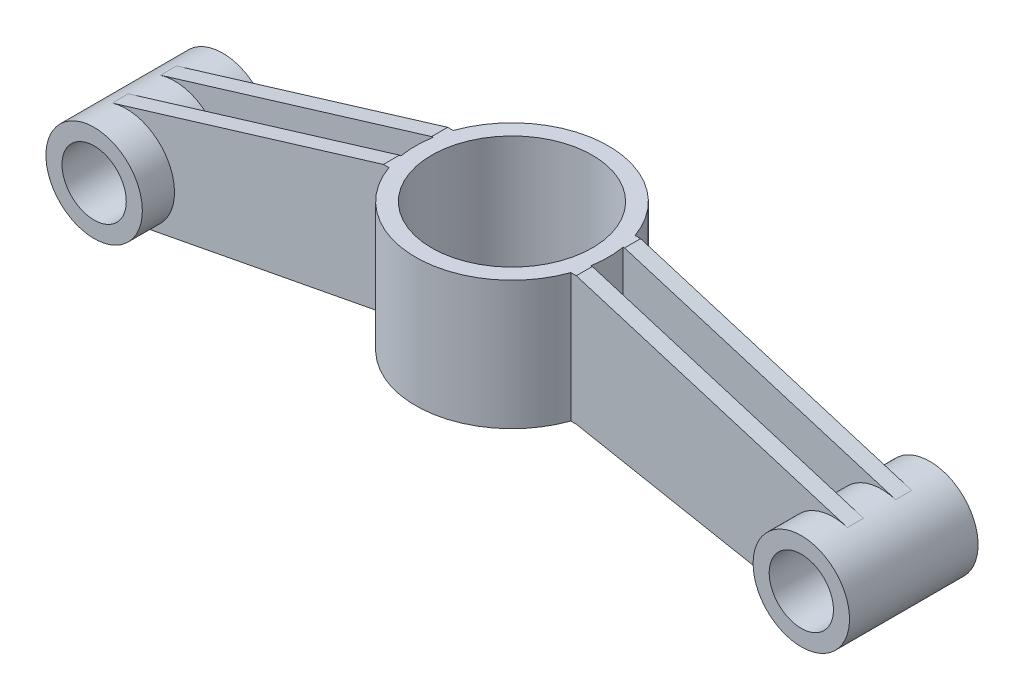
from build123d import *

# Parameters (mm, degrees)
SKETCH1_R             = 30
SKETCH1_R_2           = 25
BOSS_EXTRUDE1_DEPTH   = 40
SKETCH4_R             = 15
SKETCH4_R_2           = 10
BOSS_EXTRUDE2_DEPTH   = 20
BOSS_EXTRUDE2_2_DEPTH = 20
BOSS_EXTRUDE3_START   = 5
BOSS_EXTRUDE3_DEPTH   = 5


with BuildPart() as part:
    # Sketch1 → Boss-Extrude1 (new body)
    with BuildSketch(Plane(origin=(0, 0, 0), x_dir=(1, 0, 0), z_dir=(0, 1, 0))):
        with Locations(Location((0, 0, 0), (0, 0, 270))):
            Circle(SKETCH1_R)
        with Locations(Location((0, 0, 0), (0, 0, 270))):
            Circle(SKETCH1_R_2, mode=Mode.SUBTRACT)
    extrude(amount=BOSS_EXTRUDE1_DEPTH)


with BuildPart() as body_2:
    # Sketch4 → Boss-Extrude2 (new, symmetric)
    with BuildSketch(Plane.XY):
        with Locations((-110, 0)):
            Circle(SKETCH4_R)
        with Locations((-110, 0)):
            Circle(SKETCH4_R_2, mode=Mode.SUBTRACT)
    extrude(amount=BOSS_EXTRUDE2_DEPTH, both=True)



with BuildPart() as body_3:
    # Sketch4 → Boss-Extrude2 2 (new, symmetric)
    with BuildSketch(Plane.XY):
        with Locations(Location((110, 0, 0), (0, 0, 180))):
            Circle(SKETCH4_R)
        with Locations(Location((110, 0, 0), (0, 0, 180))):
            Circle(SKETCH4_R_2, mode=Mode.SUBTRACT)
    extrude(amount=BOSS_EXTRUDE2_2_DEPTH, both=True)


with BuildPart() as body_2_1:
    add(body_2.part)

    add(body_3.part)  # Boss-Extrude3 merges body 3
    # Sketch5 → Boss-Extrude3 (add)
    with BuildSketch(Plane.XY.offset(BOSS_EXTRUDE3_START)):
        with BuildLine():
            Line((-114.363197033, 14.351394066), (-30, 40))
            Line((-30, 40), (-25, 40))
            Line((-25, 40), (-25, 0))
            Line((-25, 0), (-30, 0))
            Line((-30, 0), (-107.1875, -14.733969043))
            ThreePointArc((-107.1875, -14.733969043), (-95.436664114, 3.59294418), (-114.363197033, 14.351394066))
        make_face()
        with BuildLine():
            Line((30, 0), (107.1875, -14.733969043))
            ThreePointArc((107.1875, -14.733969043), (95.436664114, 3.59294418), (114.363197033, 14.351394066))
            Line((114.363197033, 14.351394066), (30, 40))
            Line((30, 40), (25, 40))
            Line((25, 40), (25, 0))
            Line((25, 0), (30, 0))
        make_face()
    boss_extrude3 = extrude(amount=BOSS_EXTRUDE3_DEPTH)


with BuildPart() as part_1:
    add(part.part)

    add(body_2_1.part)  # Mirror2 merges body 2
    # Mirror2: Boss-Extrude3 across plane
    add(boss_extrude3.mirror(Plane.XY))


solid = part_1.part
